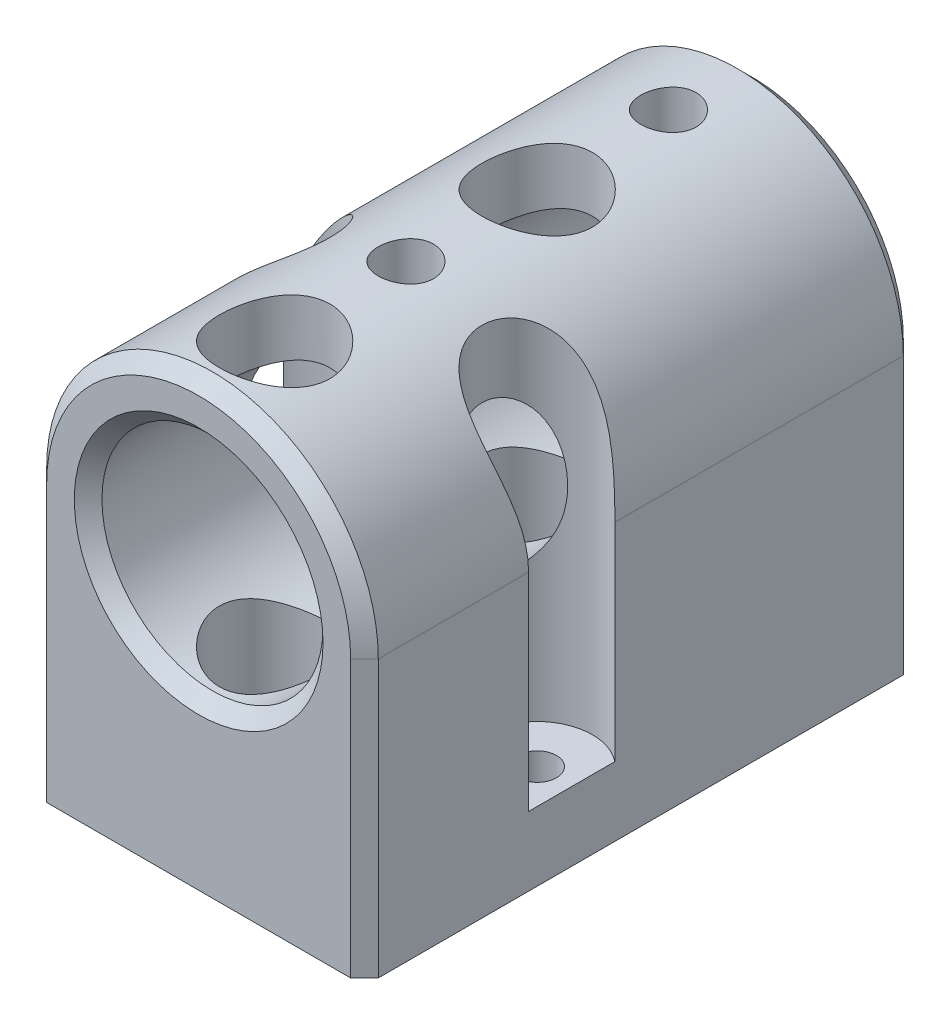
from build123d import *

# Parameters (mm, degrees)
SKETCH1_R               = 8
BOSS_EXTRUDE1_DEPTH     = 40
CUT_EXTRUDE1_DEPTH      = 53.611785752
CUT_EXTRUDE1_DEPTH_BACK = 53.611785752
SKETCH2_R               = 1.4
CUT_EXTRUDE3_DEPTH      = 47.303347767
CUT_EXTRUDE3_DEPTH_BACK = 15
SKETCH4_R               = 4
SKETCH5_R               = 2
CUT_EXTRUDE4_DEPTH      = 30
CHAMFER1_SIZE           = 1


with BuildPart() as part:
    # Sketch1 → Boss-Extrude1 (new body)
    with BuildSketch(Plane.XY):
        with BuildLine():
            Line((-12, 0), (-12, -20))
            Line((-12, -20), (12, -20))
            Line((12, -20), (12, 0))
            ThreePointArc((12, 0), (0, 12), (-12, 0))
        make_face()
        Circle(SKETCH1_R, mode=Mode.SUBTRACT)
    extrude(amount=BOSS_EXTRUDE1_DEPTH)

    # Sketch2 → Cut-Extrude1 (cut, two sides: drawn at the far end of the back side and taken through both)
    with BuildSketch(Plane.XZ.offset(20).offset(-CUT_EXTRUDE1_DEPTH_BACK)):
        with Locations(Location((-9.5, 25, 0), (0, 0, 270))):
            Circle(SKETCH2_R)
        with Locations(Location((0, 34.5, 0), (0, 0, 270))):
            Circle(SKETCH2_R)
        with Locations(Location((9.5, 25, 0), (0, 0, 270))):
            Circle(SKETCH2_R)
        with Locations(Location((0, 15.5, 0), (0, 0, 270))):
            Circle(SKETCH2_R)
    extrude(amount=CUT_EXTRUDE1_DEPTH + CUT_EXTRUDE1_DEPTH_BACK, mode=Mode.SUBTRACT)

    # Sketch4 → Cut-Extrude3 (cut, two sides: drawn at the far end of the back side and taken through both)
    with BuildSketch(Plane(origin=(0, 0, 0), x_dir=(1, 0, 0), z_dir=(0, 1, 0)).offset(-CUT_EXTRUDE3_DEPTH_BACK)):
        with Locations(Location((0, -15.5, 0), (0, 0, 90))):
            Circle(SKETCH4_R)
        with Locations(Location((0, -34.5, 0), (0, 0, 90))):
            Circle(SKETCH4_R)
        with Locations((-9.5, -25)):
            Circle(SKETCH4_R)
        with Locations((9.5, -25)):
            Circle(SKETCH4_R)
    extrude(amount=CUT_EXTRUDE3_DEPTH + CUT_EXTRUDE3_DEPTH_BACK, mode=Mode.SUBTRACT)

    # Sketch5 → Cut-Extrude4 (cut)
    with BuildSketch(Plane(origin=(0, 0, 0), x_dir=(1, 0, 0), z_dir=(0, 1, 0))):
        with Locations(Location((0, -6, 0), (0, 0, 90))):
            Circle(SKETCH5_R)
        with Locations(Location((0, -25, 0), (0, 0, 90))):
            Circle(SKETCH5_R)
    extrude(amount=CUT_EXTRUDE4_DEPTH, mode=Mode.SUBTRACT)

    # Chamfer1
    chamfer1_edges = [part.edges().sort_by_distance(p)[0] for p in [
        (-8, 0, 0),
        (-8, 0, 40),
        (12, -10, 40),
        (0, 12, 40),
        (12, -10, 0),
        (-12, -10, 0),
        (0, 12, 0),
        (-12, -10, 40),
    ]]
    chamfer(chamfer1_edges, length=CHAMFER1_SIZE)


solid = part.part
